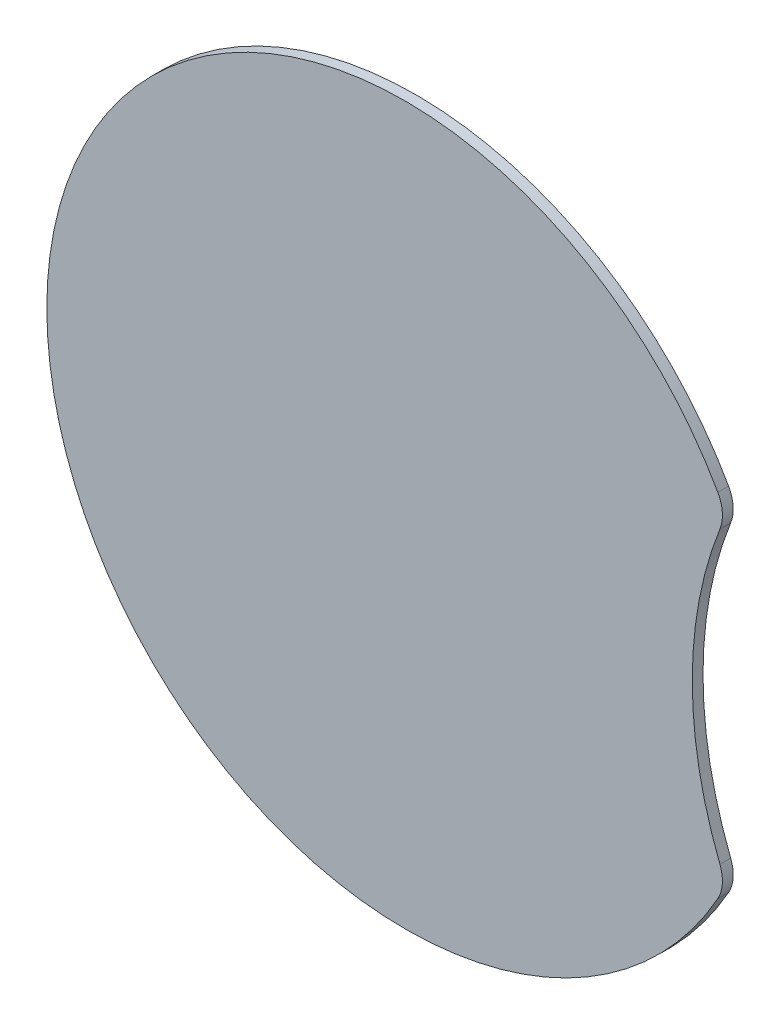
from build123d import *

# Parameters (mm, degrees)
CROQUIS1_R              = 100
SALIENTE_EXTRUIR1_DEPTH = 3
CROQUIS3_R              = 110
CORTAR_EXTRUIR1_DEPTH   = 3
REDONDEO1_R             = 10


with BuildPart() as part:
    # Croquis1 → Saliente-Extruir1 (new body)
    with BuildSketch(Plane.XY):
        Circle(CROQUIS1_R)
    extrude(amount=SALIENTE_EXTRUIR1_DEPTH)

    # Croquis3 → Cortar-Extruir1 (cut)
    with BuildSketch(Plane.XY.offset(3)):
        with Locations((190, 0)):
            Circle(CROQUIS3_R)
    extrude(amount=-CORTAR_EXTRUIR1_DEPTH, mode=Mode.SUBTRACT)

    # Redondeo1
    redondeo1_edges = [part.edges().sort_by_distance(p)[0] for p in [
        (89.473684211, -44.659375654, 1.5),
        (89.473684211, 44.659375654, 1.5),
    ]]
    fillet(redondeo1_edges, radius=REDONDEO1_R)


solid = part.part
